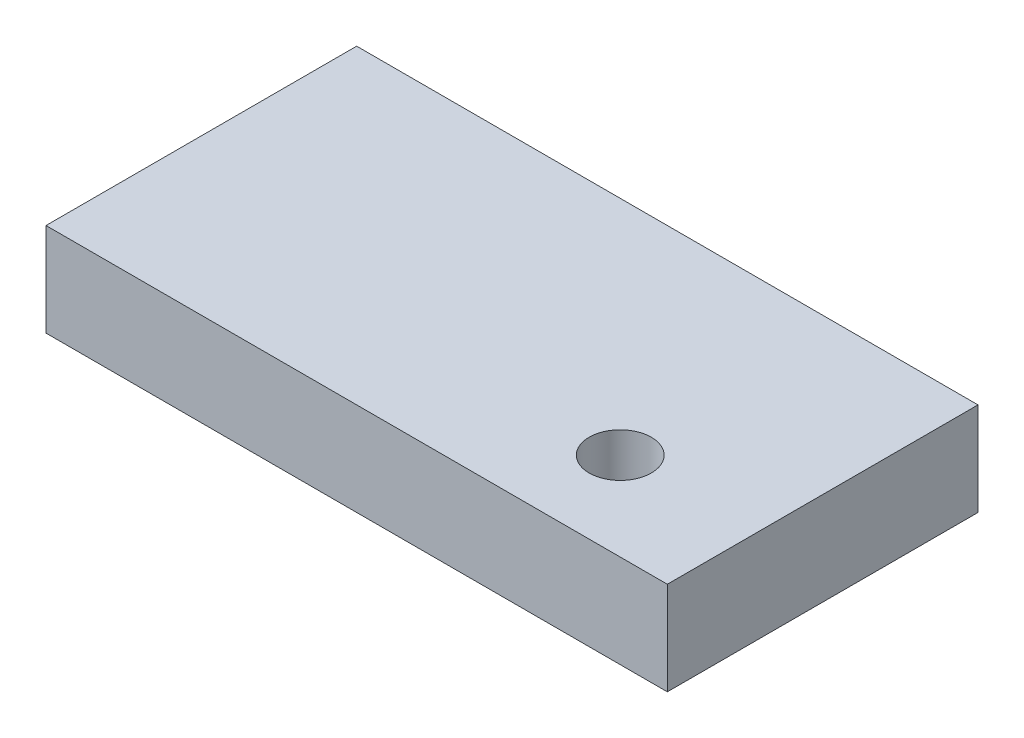
from build123d import *

# Parameters (mm, degrees)
SKETCH4_W           = 100
SKETCH4_H           = 50
BOSS_EXTRUDE3_DEPTH = 15
SKETCH5_R           = 5
CUT_EXTRUDE2_DEPTH  = 15


with BuildPart() as part:
    # Sketch4 → Boss-Extrude3 (new body)
    with BuildSketch(Plane(origin=(0, 0, 0), x_dir=(1, 0, 0), z_dir=(0, 1, 0))):
        Rectangle(SKETCH4_W, SKETCH4_H)
    extrude(amount=BOSS_EXTRUDE3_DEPTH)

    # Sketch5 → Cut-Extrude2 (cut)
    with BuildSketch(Plane(origin=(0, 15, 0), x_dir=(1, 0, 0), z_dir=(0, 1, 0))):
        with Locations(Location((28.209823651, -10.793932011, 0), (0, 0, 270))):
            Circle(SKETCH5_R)
    extrude(amount=-CUT_EXTRUDE2_DEPTH, mode=Mode.SUBTRACT)


solid = part.part
